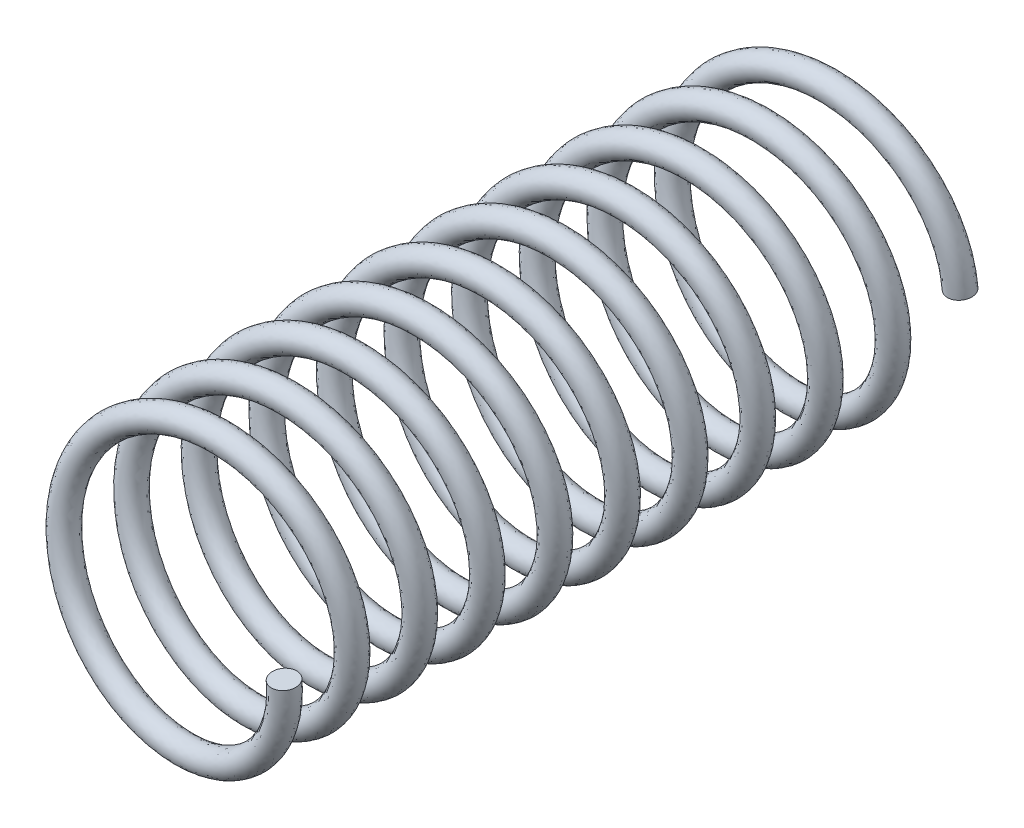
from build123d import *

# Parameters (mm, degrees)
SWEEP_1_PITCH     = 8
SWEEP_1_HEIGHT    = 80
SWEEP_1_RADIUS    = 15
SWEEP_1_PROFILE_R = 1.5


with BuildPart() as part:
    # 扫描1: sweep along a helix
    with BuildLine() as sweep_1_path:
        Helix(SWEEP_1_PITCH, SWEEP_1_HEIGHT, SWEEP_1_RADIUS, center=(0, 0, 0), direction=(0, 0, 1))
    # 扫描1 profile (on start of the path) → 扫描1 (sweep)
    with BuildSketch(Plane(origin=(15, 0, 0), x_dir=(0, -0.08457848656919516, 0.9964168202161505), z_dir=(-1.6370979944061053e-13, 0.9964168202161505, 0.08457848656919516))):
        Circle(SWEEP_1_PROFILE_R)
    sweep(path=sweep_1_path.line, is_frenet=True)


solid = part.part
